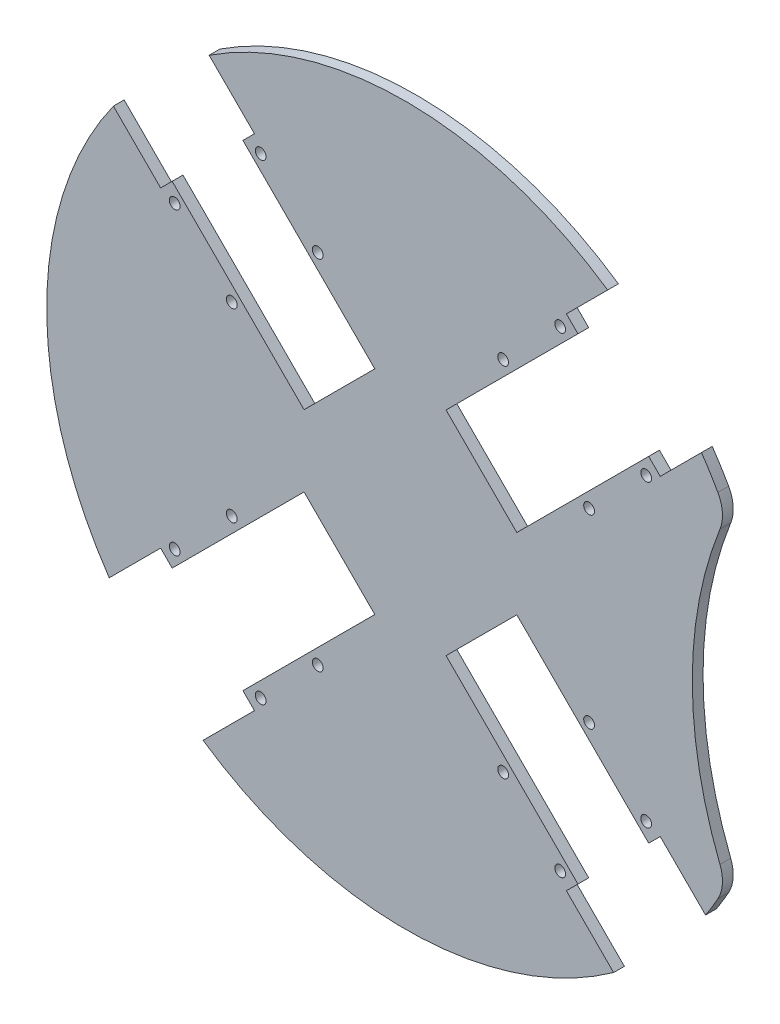
from build123d import *

# Parameters (mm, degrees)
CROQUIS1_R              = 100
SALIENTE_EXTRUIR1_DEPTH = 3
CROQUIS3_R              = 110
CORTAR_EXTRUIR1_DEPTH   = 3
REDONDEO1_R             = 10
CORTAR_EXTRUIR2_DEPTH   = 142.453172607
CROQUIS5_R              = 1.5
CORTAR_EXTRUIR3_DEPTH   = 10


with BuildPart() as part:
    # Croquis1 → Saliente-Extruir1 (new body)
    with BuildSketch(Plane.XY):
        Circle(CROQUIS1_R)
    extrude(amount=SALIENTE_EXTRUIR1_DEPTH)

    # Croquis3 → Cortar-Extruir1 (cut)
    with BuildSketch(Plane.XY.offset(3)):
        with Locations((190, 0)):
            Circle(CROQUIS3_R)
    extrude(amount=-CORTAR_EXTRUIR1_DEPTH, mode=Mode.SUBTRACT)

    # Redondeo1
    redondeo1_edges = [part.edges().sort_by_distance(p)[0] for p in [
        (89.473684211, -44.659375654, 1.5),
        (89.473684211, 44.659375654, 1.5),
    ]]
    fillet(redondeo1_edges, radius=REDONDEO1_R)

    # Croquis4 → Cortar-Extruir2 (cut, through all)
    with BuildSketch(Plane.XY.offset(3)):
        Polygon((-83.792153571, -57.629202667), (-57.629202667, -83.792153571), (-42.072853481, -68.235804385), (-45.290189335, -65.01846853), (-8.520636713, -28.248915908), (-28.248915908, -8.520636713), (-65.01846853, -45.290189335), (-68.235804385, -42.072853481), align=None)
        Polygon((-8.520636713, 31.077343033), (-28.248915908, 11.349063838), (-65.01846853, 48.11861646), (-68.235804385, 44.901280605), (-83.792153571, 60.457629791), (-57.629202667, 86.620580695), (-42.072853481, 71.064231509), (-45.290189335, 67.846895655), align=None)
        Polygon((31.077343033, 11.349063838), (11.349063838, 31.077343033), (48.11861646, 67.846895655), (44.901280605, 71.064231509), (60.457629791, 86.620580695), (86.620580695, 60.457629791), (71.064231509, 44.901280605), (67.846895655, 48.11861646), align=None)
        Polygon((11.349063838, -28.248915908), (31.077343033, -8.520636713), (67.846895655, -45.290189335), (71.064231509, -42.072853481), (86.620580695, -57.629202667), (60.457629791, -83.792153571), (44.901280605, -68.235804385), (48.11861646, -65.01846853), align=None)
    extrude(amount=-CORTAR_EXTRUIR2_DEPTH, mode=Mode.SUBTRACT)

    # Croquis5 → Cortar-Extruir3 (cut)
    with BuildSketch(Plane.XY.offset(3)):
        with Locations((-64.311361749, -40.340441867)):
            Circle(CROQUIS5_R)
        with Locations((-48.401459172, -24.43053929)):
            Circle(CROQUIS5_R)
        with Locations((-24.43053929, -48.401459172)):
            Circle(CROQUIS5_R)
        with Locations((-40.340441867, -64.311361749)):
            Circle(CROQUIS5_R)
        with Locations((-24.43053929, 51.229886297)):
            Circle(CROQUIS5_R)
        with Locations((-40.340441867, 67.139788874)):
            Circle(CROQUIS5_R)
        with Locations((-48.401459172, 27.258966415)):
            Circle(CROQUIS5_R)
        with Locations((-64.311361749, 43.168868991)):
            Circle(CROQUIS5_R)
        with Locations((51.229886297, 27.258966415)):
            Circle(CROQUIS5_R)
        with Locations((67.139788874, 43.168868991)):
            Circle(CROQUIS5_R)
        with Locations((27.258966415, 51.229886297)):
            Circle(CROQUIS5_R)
        with Locations((43.168868991, 67.139788874)):
            Circle(CROQUIS5_R)
        with Locations((27.258966415, -48.401459172)):
            Circle(CROQUIS5_R)
        with Locations((43.168868991, -64.311361749)):
            Circle(CROQUIS5_R)
        with Locations((51.229886297, -24.43053929)):
            Circle(CROQUIS5_R)
        with Locations((67.139788874, -40.340441867)):
            Circle(CROQUIS5_R)
    extrude(amount=-CORTAR_EXTRUIR3_DEPTH, mode=Mode.SUBTRACT)


solid = part.part
